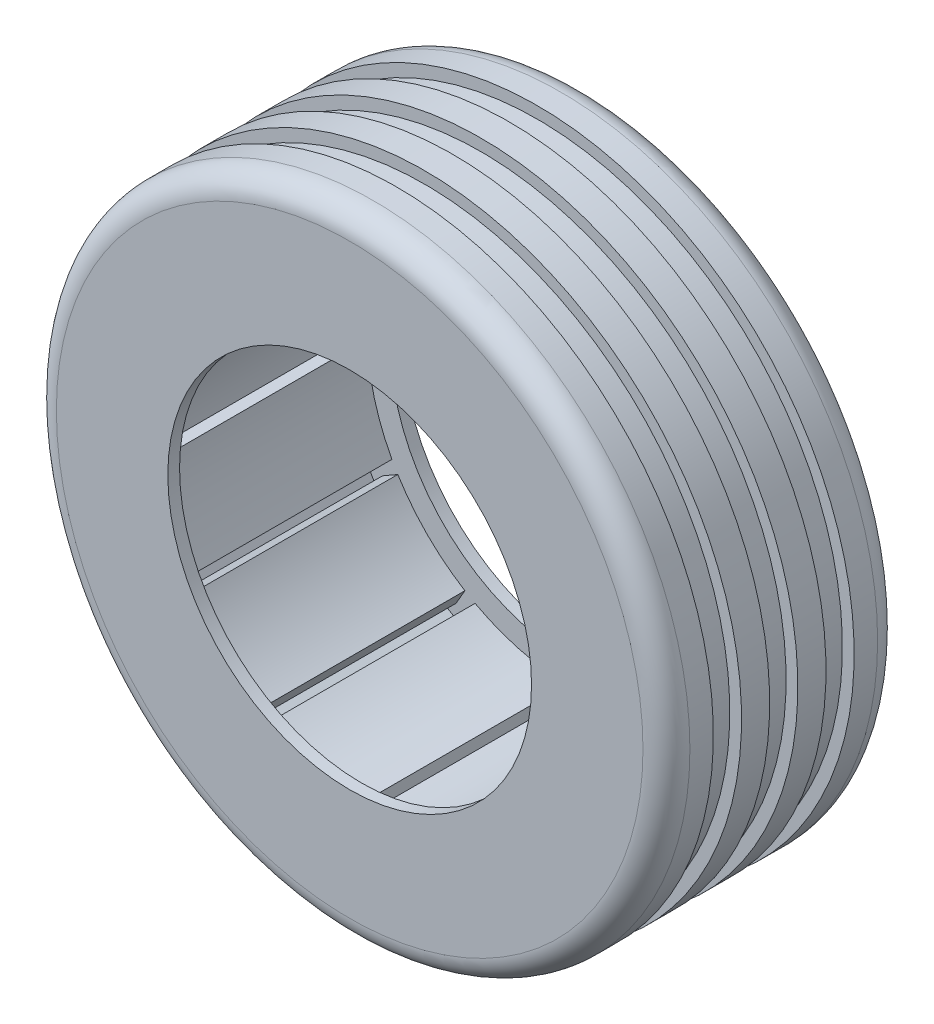
from build123d import *

# Parameters (mm, degrees)
SKETCH_1_R               = 27
EXTRUDE_1_DEPTH          = 10
FILLET_1_R               = 2
SKETCH_3_R               = 17.5
CUT_EXTRUDE_1_DEPTH      = 9
SKETCH_5_R               = 15.5
CUT_EXTRUDE_2_DEPTH      = 44.10452425
CUT_EXTRUDE_3_DEPTH      = 9
PATTERN_CIRCULAR_1_COUNT = 12
CUT_EXTRUDE_START        = -4
SKETCH_7_R               = 30.427908266
SKETCH_7_R_2             = 26
CUT_EXTRUDE_4_DEPTH      = 2.4
PATTERN_LINEAR_1_COUNT   = 3
PATTERN_LINEAR_1_PITCH   = 4.8


with BuildPart() as part:
    # 草图1 → 凸台-拉伸1 (new, symmetric)
    with BuildSketch(Plane.XY):
        Circle(SKETCH_1_R)
    extrude(amount=EXTRUDE_1_DEPTH, both=True)

    # 圆角1
    fillet_1_edges = [part.edges().sort_by_distance(p)[0] for p in [
        (-27, 0, -10),
        (-27, 0, 10),
    ]]
    fillet(fillet_1_edges, radius=FILLET_1_R)

    # 草图3 → 切除-拉伸1 (cut, symmetric)
    with BuildSketch(Plane.XY):
        Circle(SKETCH_3_R)
    extrude(amount=CUT_EXTRUDE_1_DEPTH, both=True, mode=Mode.SUBTRACT)

    # 草图5 → 切除-拉伸2 (cut, through all)
    with BuildSketch(Plane.XY.offset(10)):
        Circle(SKETCH_5_R)
    extrude(amount=-CUT_EXTRUDE_2_DEPTH, mode=Mode.SUBTRACT)

    # 草图6 → 切除-拉伸3 (cut, symmetric)
    with BuildSketch(Plane.XY):
        with BuildLine():
            Line((0.5, 17.492855685), (0.5, 19))
            Line((0.5, 19), (2, 19))
            Line((2, 19), (2, 20))
            Line((2, 20), (-2, 20))
            Line((-2, 20), (-2, 19))
            Line((-2, 19), (-0.5, 19))
            Line((-0.5, 19), (-0.5, 17.492855685))
            ThreePointArc((-0.5, 17.492855685), (0, 17.5), (0.5, 17.492855685))
        make_face()
    cut_extrude_3 = extrude(amount=CUT_EXTRUDE_3_DEPTH, both=True, mode=Mode.SUBTRACT)

    # 阵列(圆周)1: 切除-拉伸3 ×12 about axis
    pattern_circular_1_axis = Axis((0, 0, 0), (0, 0, 1))
    for i in range(1, PATTERN_CIRCULAR_1_COUNT):
        add(cut_extrude_3.rotate(pattern_circular_1_axis, i * 360 / PATTERN_CIRCULAR_1_COUNT), mode=Mode.SUBTRACT)

    # 草图7 → 切除-拉伸4 (cut)
    with BuildSketch(Plane(origin=(0, 0, -10), x_dir=(-1, 0, 0), z_dir=(0, 0, -1)).offset(CUT_EXTRUDE_START)):
        Circle(SKETCH_7_R)
        Circle(SKETCH_7_R_2, mode=Mode.SUBTRACT)
    cut_extrude_4 = extrude(amount=-CUT_EXTRUDE_4_DEPTH, mode=Mode.SUBTRACT)

    # 阵列(线性)1: 切除-拉伸4 ×3
    with Locations(*[(0, 0, i * PATTERN_LINEAR_1_PITCH) for i in range(1, PATTERN_LINEAR_1_COUNT)]):
        add(cut_extrude_4, mode=Mode.SUBTRACT)


solid = part.part
